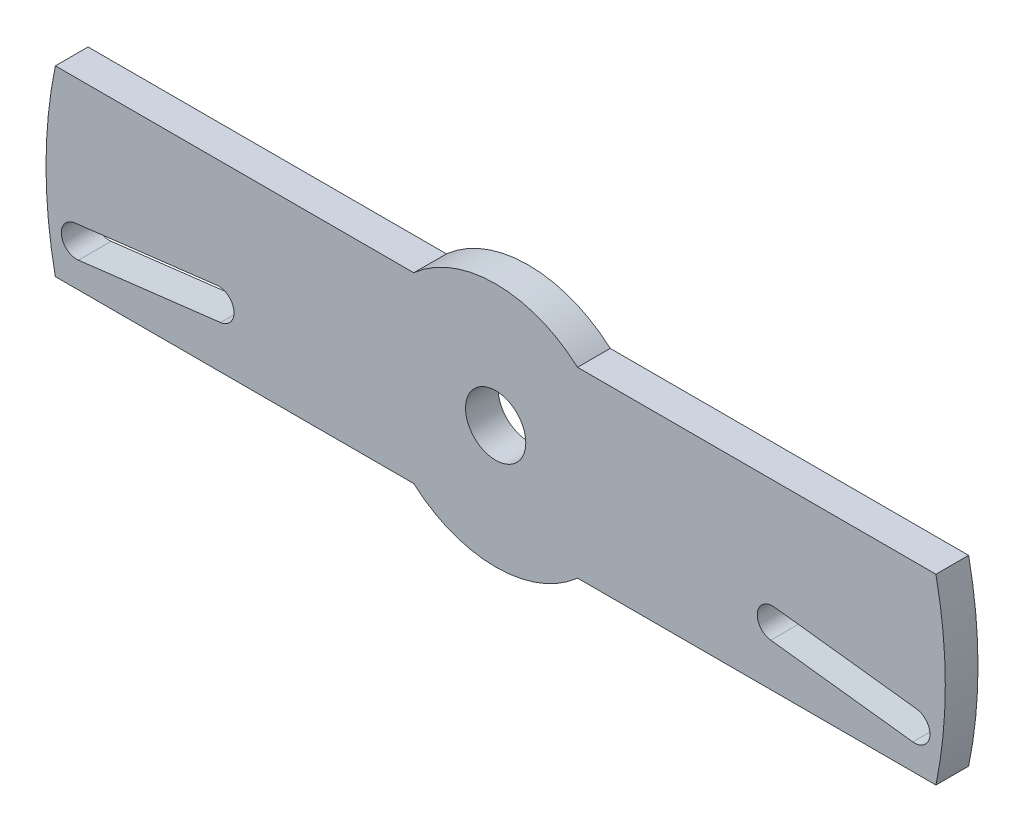
from build123d import *

# Parameters (mm, degrees)
SKETCH_1_R      = 2.95
EXTRUDE_1_DEPTH = 3.2


with BuildPart() as part:
    # Эскиз1 → Бобышка-Вытянуть1 (new body)
    with BuildSketch(Plane.XY):
        with BuildLine():
            Line((-43.083575227, 8.933394968), (-8.012144179, 8.933394968))
            ThreePointArc((-8.012144179, 8.933394968), (0, 12), (8.012144179, 8.933394968))
            Line((8.012144179, 8.933394968), (43.083575227, 8.933394968))
            ThreePointArc((43.083575227, 8.933394968), (44, 0), (43.083575227, -8.933394968))
            Line((43.083575227, -8.933394968), (8.012144179, -8.933394968))
            ThreePointArc((8.012144179, -8.933394968), (0, -12), (-8.012144179, -8.933394968))
            Line((-8.012144179, -8.933394968), (-43.083575227, -8.933394968))
            ThreePointArc((-43.083575227, -8.933394968), (-44, 0), (-43.083575227, 8.933394968))
        make_face()
        Circle(SKETCH_1_R, mode=Mode.SUBTRACT)
        with BuildLine():
            Line((-41.178612038, -3.427717743), (-27.278217848, -1.760672051))
            ThreePointArc((-27.278217848, -1.760672051), (-25.61027786, -3.071387962), (-26.920993771, -4.739327949))
            Line((-26.920993771, -4.739327949), (-40.821387962, -6.406373641))
            ThreePointArc((-40.821387962, -6.406373641), (-42.489327949, -5.09565773), (-41.178612038, -3.427717743))
        make_face(mode=Mode.SUBTRACT)
        with BuildLine():
            Line((40.821387962, -6.406373641), (26.920993771, -4.739327949))
            ThreePointArc((26.920993771, -4.739327949), (25.61027786, -3.071387962), (27.278217848, -1.760672051))
            Line((27.278217848, -1.760672051), (41.178612038, -3.427717743))
            ThreePointArc((41.178612038, -3.427717743), (42.489327949, -5.09565773), (40.821387962, -6.406373641))
        make_face(mode=Mode.SUBTRACT)
    extrude(amount=EXTRUDE_1_DEPTH)


solid = part.part
